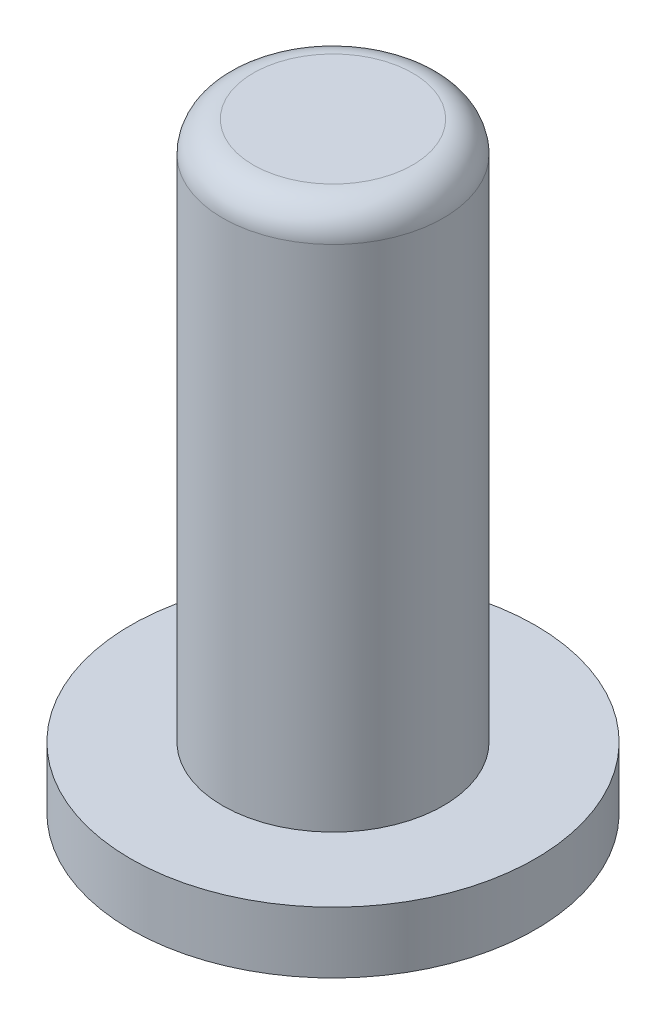
from build123d import *

# Parameters (mm, degrees)
SKETCH_1_R      = 3.3
EXTRUDE_1_DEPTH = 1
SKETCH_2_R      = 1.8
EXTRUDE_2_DEPTH = 8.8
FILLET_1_R      = 0.5


with BuildPart() as part:
    # 草图1 → 凸台-拉伸1 (new body)
    with BuildSketch(Plane(origin=(0, 0, 0), x_dir=(1, 0, 0), z_dir=(0, 1, 0))):
        with Locations(Location((0, 0, 0), (0, 0, 270))):
            Circle(SKETCH_1_R)
    extrude(amount=EXTRUDE_1_DEPTH)

    # 草图2 → 凸台-拉伸2 (add)
    with BuildSketch(Plane(origin=(0, 1, 0), x_dir=(1, 0, 0), z_dir=(0, 1, 0))):
        with Locations(Location((0, 0, 0), (0, 0, 270))):
            Circle(SKETCH_2_R)
    extrude(amount=EXTRUDE_2_DEPTH)

    # 圆角1
    fillet_1_edges = [part.edges().sort_by_distance(p)[0] for p in [
        (0, 9.8, -1.8),
    ]]
    fillet(fillet_1_edges, radius=FILLET_1_R)


solid = part.part
